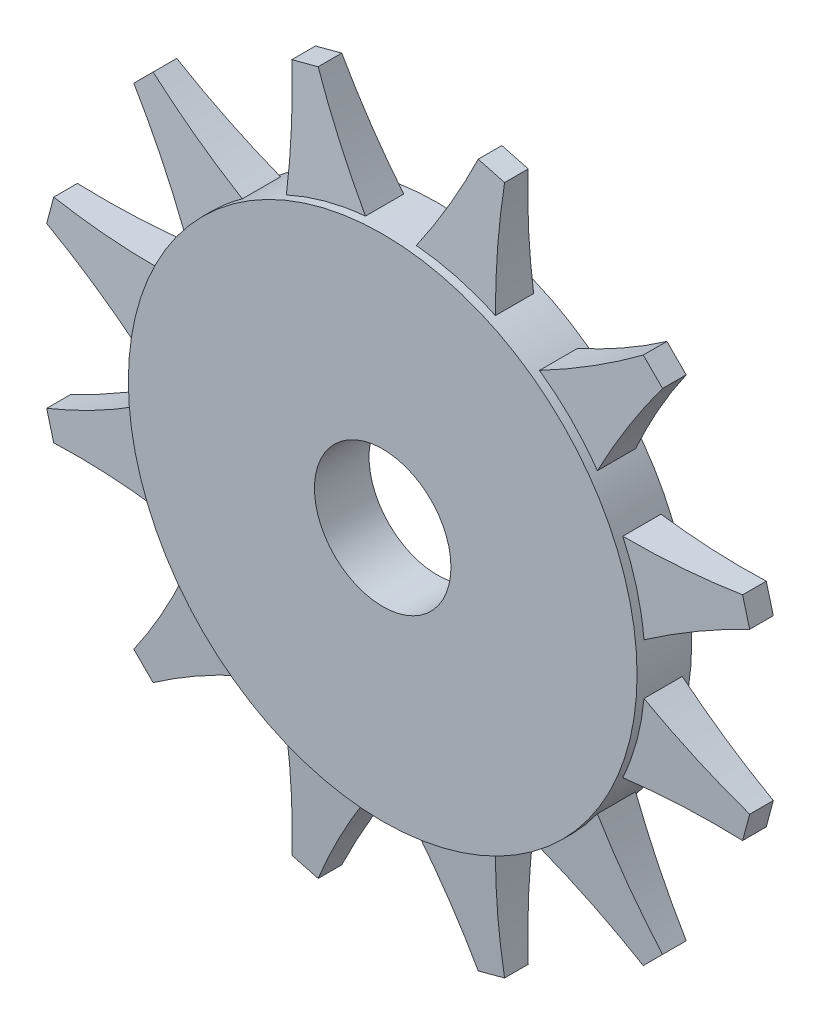
from build123d import *

# Parameters (mm, degrees)
BOSS_EXTRUDE1_DEPTH = 2
CUT_EXTRUDE1_DEPTH  = 2
CIRPATTERN1_COUNT   = 12
SKETCH6_R           = 9.317683155
SKETCH6_R_2         = 2.5
BOSS_EXTRUDE2_DEPTH = 2


with BuildPart() as part:
    # Sketch3 → Boss-Extrude1 (new body)
    with BuildSketch(Plane.XY):
        with BuildLine():
            Line((-7.563321911, 5.442001567), (-5.442001567, 7.563321911))
            add(Edge.make_bspline(
                [(-8.977535473, 9.684642254), (-7.300218474, 8.473386816), (-5.442001567, 7.563321911)],
                knots=[0, 0, 0, 1, 1, 1], degree=2))
            Line((-8.977535473, 9.684642254), (-9.684642254, 8.977535473))
            add(Edge.make_bspline(
                [(-9.684642254, 8.977535473), (-8.473386816, 7.300218474), (-7.563321911, 5.442001567)],
                knots=[0, 0, 0, 1, 1, 1], degree=2))
        make_face()
    extrude(amount=BOSS_EXTRUDE1_DEPTH)

    # Sketch4 → Cut-Extrude1 (cut, symmetric)
    with BuildSketch(Plane(origin=(0, 0, 0), x_dir=(0, 0, -1), z_dir=(-0.707106781186548, -0.7071067811865471, 0))):
        Polygon((0, -9.196152423), (-0.3, -9.196152423), (-0.6, -13.696152423), (0, -13.696152423), align=None)
        Polygon((-1.7, -9.196152423), (-2, -9.196152423), (-2, -13.696152423), (-1.4, -13.696152423), align=None)
    extrude(amount=CUT_EXTRUDE1_DEPTH, both=True, mode=Mode.SUBTRACT)


with BuildPart() as cirpattern1_1:
    # CirPattern1: pattern copy
    add(part.part.rotate(Axis((0, 0, 0), (0, 0, -1)), 1 * 360 / CIRPATTERN1_COUNT))


with BuildPart() as cirpattern1_2:
    # CirPattern1: pattern copy
    add(part.part.rotate(Axis((0, 0, 0), (0, 0, -1)), 2 * 360 / CIRPATTERN1_COUNT))


with BuildPart() as cirpattern1_3:
    # CirPattern1: pattern copy
    add(part.part.rotate(Axis((0, 0, 0), (0, 0, -1)), 3 * 360 / CIRPATTERN1_COUNT))


with BuildPart() as cirpattern1_4:
    # CirPattern1: pattern copy
    add(part.part.rotate(Axis((0, 0, 0), (0, 0, -1)), 4 * 360 / CIRPATTERN1_COUNT))


with BuildPart() as cirpattern1_5:
    # CirPattern1: pattern copy
    add(part.part.rotate(Axis((0, 0, 0), (0, 0, -1)), 5 * 360 / CIRPATTERN1_COUNT))


with BuildPart() as cirpattern1_6:
    # CirPattern1: pattern copy
    add(part.part.rotate(Axis((0, 0, 0), (0, 0, -1)), 6 * 360 / CIRPATTERN1_COUNT))


with BuildPart() as cirpattern1_7:
    # CirPattern1: pattern copy
    add(part.part.rotate(Axis((0, 0, 0), (0, 0, -1)), 7 * 360 / CIRPATTERN1_COUNT))


with BuildPart() as cirpattern1_8:
    # CirPattern1: pattern copy
    add(part.part.rotate(Axis((0, 0, 0), (0, 0, -1)), 8 * 360 / CIRPATTERN1_COUNT))


with BuildPart() as cirpattern1_9:
    # CirPattern1: pattern copy
    add(part.part.rotate(Axis((0, 0, 0), (0, 0, -1)), 9 * 360 / CIRPATTERN1_COUNT))


with BuildPart() as cirpattern1_10:
    # CirPattern1: pattern copy
    add(part.part.rotate(Axis((0, 0, 0), (0, 0, -1)), 10 * 360 / CIRPATTERN1_COUNT))


with BuildPart() as cirpattern1_11:
    # CirPattern1: pattern copy
    add(part.part.rotate(Axis((0, 0, 0), (0, 0, -1)), 11 * 360 / CIRPATTERN1_COUNT))


with BuildPart() as part_1:
    add(part.part)

    add(cirpattern1_1.part)  # Boss-Extrude2 merges CirPattern1_1

    add(cirpattern1_2.part)  # Boss-Extrude2 merges CirPattern1_2

    add(cirpattern1_3.part)  # Boss-Extrude2 merges CirPattern1_3

    add(cirpattern1_4.part)  # Boss-Extrude2 merges CirPattern1_4

    add(cirpattern1_5.part)  # Boss-Extrude2 merges CirPattern1_5

    add(cirpattern1_6.part)  # Boss-Extrude2 merges CirPattern1_6

    add(cirpattern1_7.part)  # Boss-Extrude2 merges CirPattern1_7

    add(cirpattern1_8.part)  # Boss-Extrude2 merges CirPattern1_8

    add(cirpattern1_9.part)  # Boss-Extrude2 merges CirPattern1_9

    add(cirpattern1_10.part)  # Boss-Extrude2 merges CirPattern1_10

    add(cirpattern1_11.part)  # Boss-Extrude2 merges CirPattern1_11
    # Sketch6 → Boss-Extrude2 (add)
    with BuildSketch(Plane.XY):
        Circle(SKETCH6_R)
        Circle(SKETCH6_R_2, mode=Mode.SUBTRACT)
    extrude(amount=BOSS_EXTRUDE2_DEPTH)


solid = part_1.part
